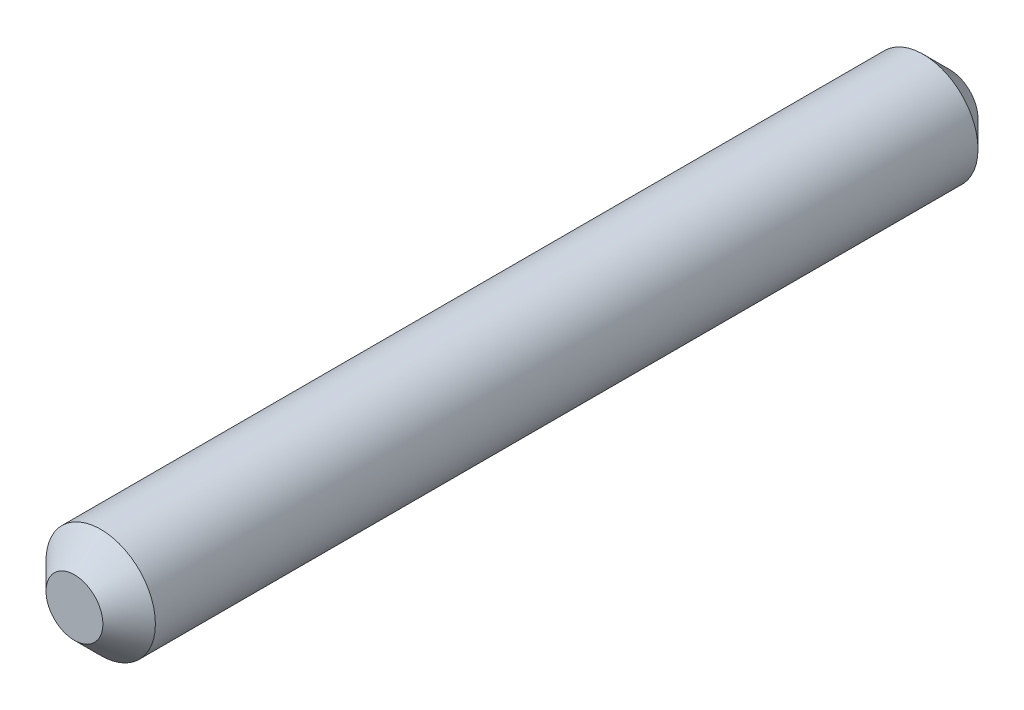
from build123d import *

# Parameters (mm, degrees)
SKETCH1_R           = 1.5875
BOSS_EXTRUDE1_DEPTH = 25.4
CHAMFER2_SIZE       = 0.762


with BuildPart() as part:
    # Sketch1 → Boss-Extrude1 (new body)
    with BuildSketch(Plane.XY):
        Circle(SKETCH1_R)
    extrude(amount=BOSS_EXTRUDE1_DEPTH)

    # Chamfer2
    chamfer2_edges = [part.edges().sort_by_distance(p)[0] for p in [
        (-1.5875, 0, 0),
        (-1.5875, 0, 25.4),
    ]]
    chamfer(chamfer2_edges, length=CHAMFER2_SIZE)


solid = part.part
